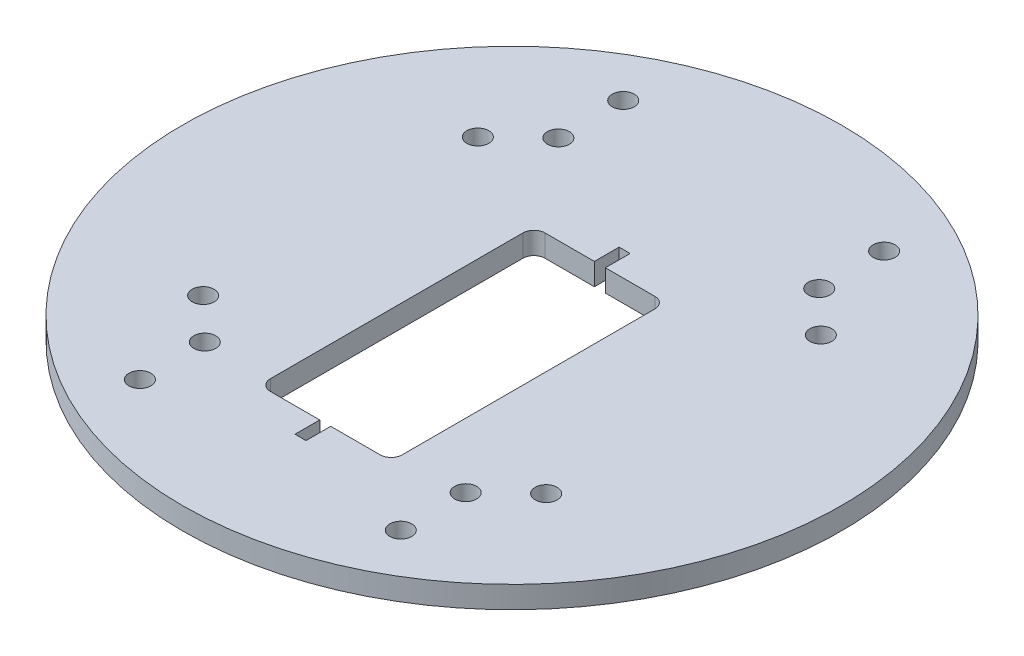
from build123d import *

# Parameters (mm, degrees)
SKETCH1_R               = 30
SKETCH1_R_2             = 1
BOSS_EXTRUDE1_DEPTH     = 2
CUT_EXTRUDE1_DEPTH      = 43.473521163
CUT_EXTRUDE1_DEPTH_BACK = 43.473521163


with BuildPart() as part:
    # Sketch1 → Boss-Extrude1 (new body)
    with BuildSketch(Plane(origin=(0, 0, 0), x_dir=(1, 0, 0), z_dir=(0, 1, 0))):
        with Locations(Location((0, 0, 0), (0, 0, 270))):
            Circle(SKETCH1_R)
        with Locations(Location((-11.874342087, 22, 0), (0, 0, 270))):
            Circle(SKETCH1_R_2, mode=Mode.SUBTRACT)
        with Locations(Location((11.874342087, 22, 0), (0, 0, 270))):
            Circle(SKETCH1_R_2, mode=Mode.SUBTRACT)
        with Locations(Location((11.874342087, -22, 0), (0, 0, 270))):
            Circle(SKETCH1_R_2, mode=Mode.SUBTRACT)
        with Locations(Location((-11.874342087, -22, 0), (0, 0, 270))):
            Circle(SKETCH1_R_2, mode=Mode.SUBTRACT)
        with Locations(Location((-11.874342087, 16.093476939, 0), (0, 0, 270))):
            Circle(SKETCH1_R_2, mode=Mode.SUBTRACT)
        with Locations(Location((11.874342087, 16.093476939, 0), (0, 0, 270))):
            Circle(SKETCH1_R_2, mode=Mode.SUBTRACT)
        with Locations(Location((11.874342087, -16.093476939, 0), (0, 0, 270))):
            Circle(SKETCH1_R_2, mode=Mode.SUBTRACT)
        with Locations(Location((-11.874342087, -16.093476939, 0), (0, 0, 270))):
            Circle(SKETCH1_R_2, mode=Mode.SUBTRACT)
        with Locations(Location((-15.612494996, 12.5, 0), (0, 0, 270))):
            Circle(SKETCH1_R_2, mode=Mode.SUBTRACT)
        with Locations(Location((15.612494996, 12.5, 0), (0, 0, 270))):
            Circle(SKETCH1_R_2, mode=Mode.SUBTRACT)
        with Locations(Location((15.612494996, -12.5, 0), (0, 0, 270))):
            Circle(SKETCH1_R_2, mode=Mode.SUBTRACT)
        with Locations(Location((-15.612494996, -12.5, 0), (0, 0, 270))):
            Circle(SKETCH1_R_2, mode=Mode.SUBTRACT)
    extrude(amount=BOSS_EXTRUDE1_DEPTH)

    # Sketch2 → Cut-Extrude1 (cut, two sides: drawn at the far end of the back side and taken through both)
    with BuildSketch(Plane(origin=(0, 2, 0), x_dir=(1, 0, 0), z_dir=(0, 1, 0)).offset(-CUT_EXTRUDE1_DEPTH_BACK)):
        with BuildLine():
            Line((-5, 8), (-0.5, 8))
            Line((-0.5, 8), (-0.5, 10.25))
            Line((-0.5, 10.25), (0.5, 10.25))
            Line((0.5, 10.25), (0.5, 8))
            Line((0.5, 8), (5, 8))
            ThreePointArc((5, 8), (5.707106781, 7.707106781), (6, 7))
            Line((6, 7), (6, -16))
            ThreePointArc((6, -16), (5.707106781, -16.707106781), (5, -17))
            Line((5, -17), (0.5, -17))
            Line((0.5, -17), (0.5, -19.25))
            Line((0.5, -19.25), (-0.5, -19.25))
            Line((-0.5, -19.25), (-0.5, -17))
            Line((-0.5, -17), (-5, -17))
            ThreePointArc((-5, -17), (-5.707106781, -16.707106781), (-6, -16))
            Line((-6, -16), (-6, 7))
            ThreePointArc((-6, 7), (-5.707106781, 7.707106781), (-5, 8))
        make_face()
    extrude(amount=CUT_EXTRUDE1_DEPTH + CUT_EXTRUDE1_DEPTH_BACK, mode=Mode.SUBTRACT)


solid = part.part
